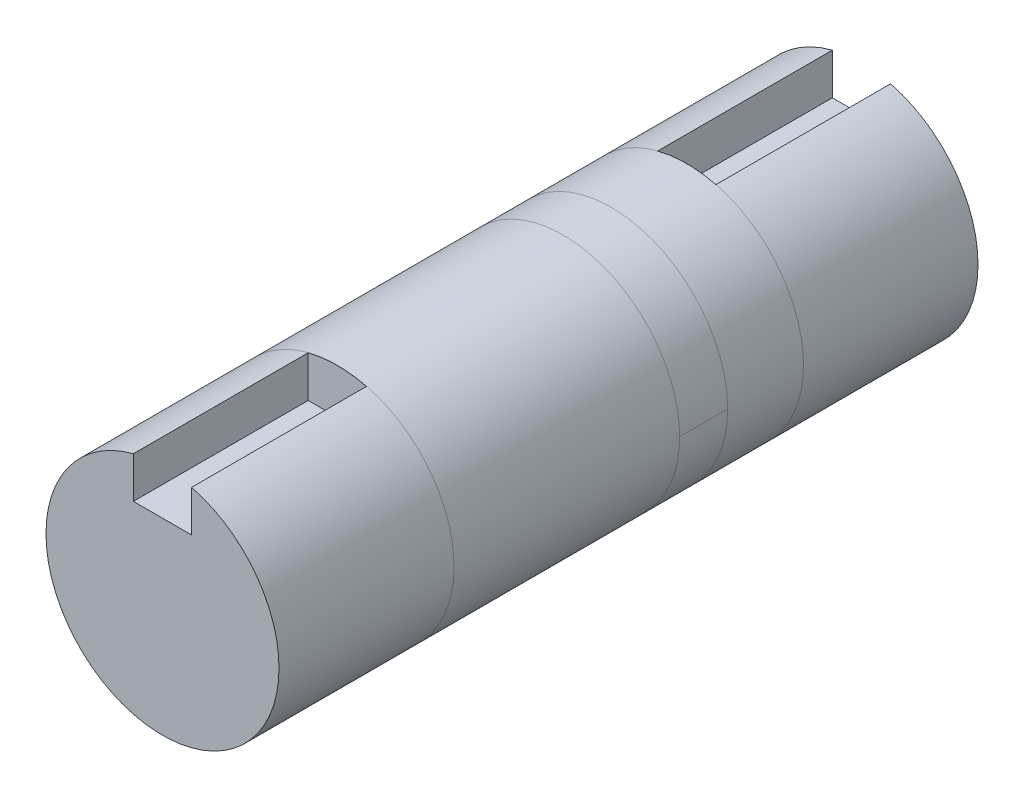
from build123d import *

# Parameters (mm, degrees)
SKETCH1_R           = 100
BOSS_EXTRUDE1_DEPTH = 600
SKETCH2_W           = 50
SKETCH2_H           = 50
CUT_EXTRUDE1_DEPTH  = 150
SKETCH3_W           = 50
SKETCH3_H           = 50
CUT_EXTRUDE2_DEPTH  = 150


with BuildPart() as part:
    # Sketch1 → Boss-Extrude1 (new body)
    with BuildSketch(Plane.XY):
        Circle(SKETCH1_R)
    extrude(amount=-BOSS_EXTRUDE1_DEPTH)

    # Sketch2 → Cut-Extrude1 (cut)
    with BuildSketch(Plane.XY):
        with Locations((0, 86.4)):
            Rectangle(SKETCH2_W, SKETCH2_H)
    extrude(amount=-CUT_EXTRUDE1_DEPTH, mode=Mode.SUBTRACT)

    # Sketch3 → Cut-Extrude2 (cut)
    with BuildSketch(Plane(origin=(0, 0, -600), x_dir=(-1, 0, 0), z_dir=(0, 0, -1))):
        with Locations((0, 86.4)):
            Rectangle(SKETCH3_W, SKETCH3_H)
    extrude(amount=-CUT_EXTRUDE2_DEPTH, mode=Mode.SUBTRACT)


solid = part.part
